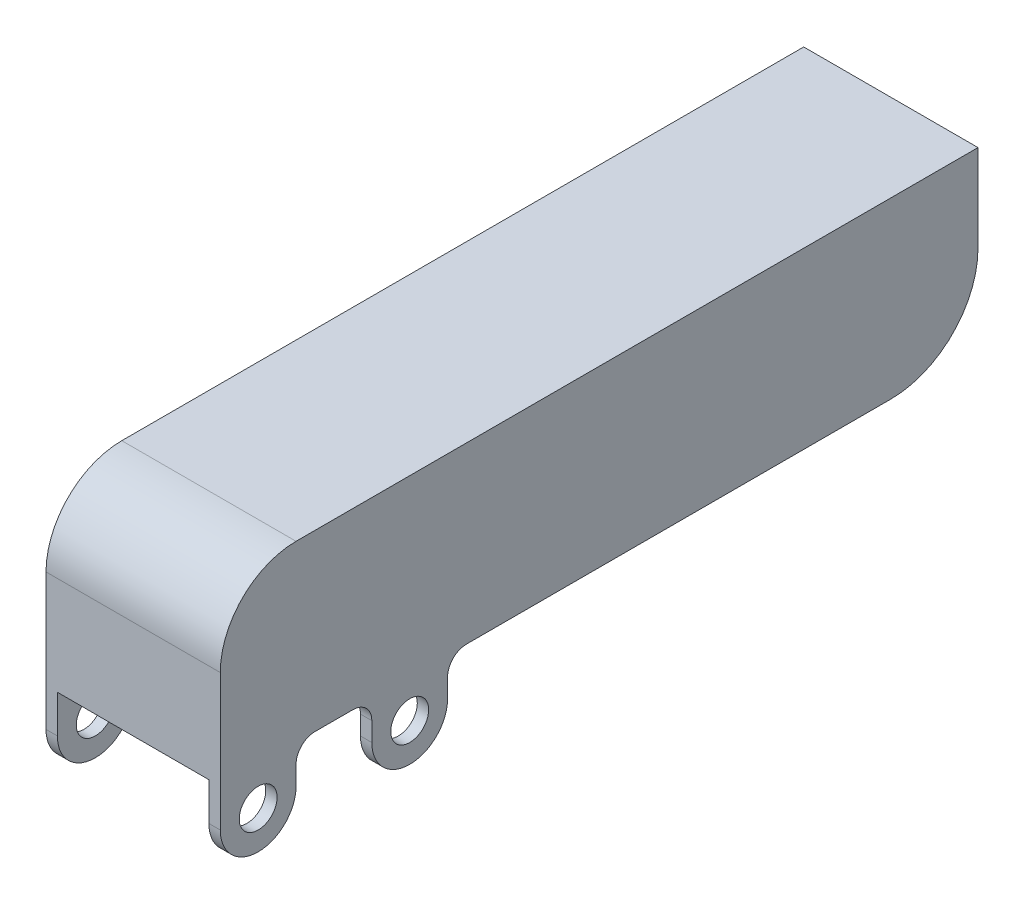
from build123d import *

# Parameters (mm, degrees)
PROFILE_EXTRUDE_DEPTH               = 23
PROFILE_EXTRUDE_DEPTH_BACK          = 23
PROFILE_SHELL_T                     = -3
CUFF_JOINT_PIN_SKETCH_R             = 7.5
CUFF_JOIN_PIN_EXTRUDE_DEPTH         = 43
HYDRAULIC_ARM_HOLES_SKETCH_R        = 5
HYDRAULIC_ARM_HOLES_EXTRUDE_1_DEPTH = 3
HYDRAULIC_START                     = -43
HYDRAULIC_ARM_HOLES_SKETCH_2_R      = 5
HYDRAULIC_ARM_HOLES_EXTRUDE_2_DEPTH = 3
HOLES_TABS_FILLET_R                 = 5


with BuildPart() as part:
    # Profile Sketch → Profile Extrude (new, two sides: drawn at the far end of the back side and taken through both)
    with BuildSketch(Plane(origin=(0, 0, 0), x_dir=(0, 0, -1), z_dir=(1, 0, 0)).offset(-PROFILE_EXTRUDE_DEPTH_BACK)):
        with BuildLine():
            Line((-80, 23), (100, 23))
            Line((100, 23), (100, 0))
            ThreePointArc((100, 0), (93.263455967, -16.263455967), (77, -23))
            Line((77, -23), (-100, -23))
            Line((-100, -23), (-100, 3))
            ThreePointArc((-100, 3), (-94.142135624, 17.142135624), (-80, 23))
        make_face()
    extrude(amount=PROFILE_EXTRUDE_DEPTH + PROFILE_EXTRUDE_DEPTH_BACK)

    # Profile Shell
    profile_shell_openings = [part.faces().sort_by_distance(p)[0] for p in [
        (0, 11.5, -100),
        (0, -16.263455967, -93.263455967),
        (0, -23, 11.5),
    ]]
    offset(amount=PROFILE_SHELL_T, openings=profile_shell_openings, kind=Kind.INTERSECTION)

    # Cuff Joint Pin Sketch → Cuff Join Pin Extrude (add)
    with BuildSketch(Plane(origin=(23, 0, 0), x_dir=(0, 0, -1), z_dir=(1, 0, 0))):
        with Locations((77, 0)):
            Circle(CUFF_JOINT_PIN_SKETCH_R)
    extrude(amount=-CUFF_JOIN_PIN_EXTRUDE_DEPTH)

    # Hydraulic Arm Holes Sketch → Hydraulic Arm Holes Extrude 1 (add)
    # profile 1 of 2: a face of its own
    with BuildSketch(Plane(origin=(23, 0, 0), x_dir=(0, 0, -1), z_dir=(1, 0, 0))):
        with BuildLine():
            Line((-100, -23), (-100, -33))
            ThreePointArc((-100, -33), (-90, -43), (-80, -33))
            Line((-80, -33), (-80, -23))
            Line((-80, -23), (-100, -23))
        make_face()
        with Locations((-90, -33)):
            Circle(HYDRAULIC_ARM_HOLES_SKETCH_R, mode=Mode.SUBTRACT)
    # profile 2 of 2: a face of its own
    with BuildSketch(Plane(origin=(23, 0, 0), x_dir=(0, 0, -1), z_dir=(1, 0, 0))):
        with BuildLine():
            Line((-60, -33), (-60, -23))
            Line((-60, -23), (-40, -23))
            Line((-40, -23), (-40, -33))
            ThreePointArc((-40, -33), (-50, -43), (-60, -33))
        make_face()
        with Locations((-50, -33)):
            Circle(HYDRAULIC_ARM_HOLES_SKETCH_R, mode=Mode.SUBTRACT)
    extrude(amount=-HYDRAULIC_ARM_HOLES_EXTRUDE_1_DEPTH)

    # Hydraulic Arm Holes Sketch<2> → Hydraulic Arm Holes Extrude 2 (add)
    # profile 1 of 2: a face of its own
    with BuildSketch(Plane(origin=(23, 0, 0), x_dir=(0, 0, -1), z_dir=(1, 0, 0)).offset(HYDRAULIC_START)):
        with BuildLine():
            Line((-100, -23), (-100, -33))
            ThreePointArc((-100, -33), (-90, -43), (-80, -33))
            Line((-80, -33), (-80, -23))
            Line((-80, -23), (-100, -23))
        make_face()
        with Locations((-90, -33)):
            Circle(HYDRAULIC_ARM_HOLES_SKETCH_2_R, mode=Mode.SUBTRACT)
    # profile 2 of 2: a face of its own
    with BuildSketch(Plane(origin=(23, 0, 0), x_dir=(0, 0, -1), z_dir=(1, 0, 0)).offset(HYDRAULIC_START)):
        with BuildLine():
            Line((-60, -33), (-60, -23))
            Line((-60, -23), (-40, -23))
            Line((-40, -23), (-40, -33))
            ThreePointArc((-40, -33), (-50, -43), (-60, -33))
        make_face()
        with Locations((-50, -33)):
            Circle(HYDRAULIC_ARM_HOLES_SKETCH_2_R, mode=Mode.SUBTRACT)
    extrude(amount=-HYDRAULIC_ARM_HOLES_EXTRUDE_2_DEPTH)

    # Holes Tabs Fillet
    holes_tabs_fillet_edges = [part.edges().sort_by_distance(p)[0] for p in [
        (-21.5, -23, 80),
        (21.5, -23, 40),
        (21.5, -23, 60),
        (21.5, -23, 80),
        (-21.5, -23, 40),
        (-21.5, -23, 60),
    ]]
    fillet(holes_tabs_fillet_edges, radius=HOLES_TABS_FILLET_R)


solid = part.part
